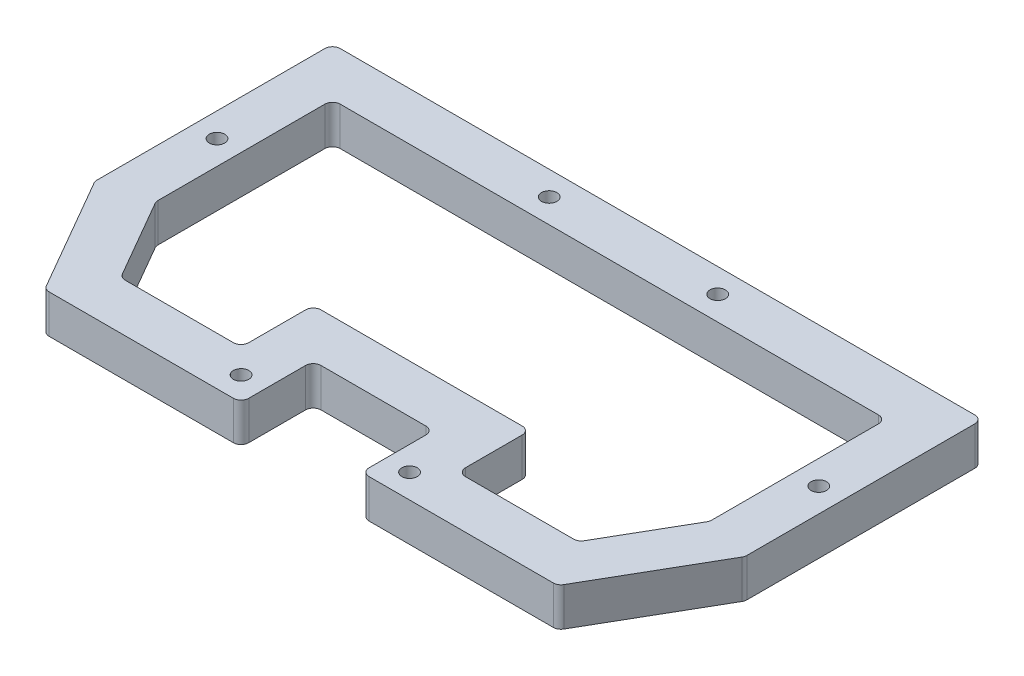
from build123d import *

# Parameters (mm, degrees)
SKETCH_1_R      = 1.6
EXTRUDE_1_DEPTH = 8
FILLET_1_R      = 1.6


with BuildPart() as part:
    # 草图1 → 凸台-拉伸1 (new body)
    with BuildSketch(Plane(origin=(0, 0, 0), x_dir=(1, 0, 0), z_dir=(0, 1, 0))):
        Polygon((-67.5, 74), (-67.5, 24.641016151), (-53.273502692, 0), (-12.5, 0), (-12.5, 15), (12.5, 15), (12.5, 0), (53.273502692, 0), (67.5, 24.641016151), (67.5, 74), align=None)
        with Locations(Location((17.5, 5, 0), (0, 0, 270))):
            Circle(SKETCH_1_R, mode=Mode.SUBTRACT)
        with Locations(Location((-62.5, 45, 0), (0, 0, 270))):
            Circle(SKETCH_1_R, mode=Mode.SUBTRACT)
        with Locations(Location((17.5, 69, 0), (0, 0, 270))):
            Circle(SKETCH_1_R, mode=Mode.SUBTRACT)
        with Locations(Location((-17.5, 5, 0), (0, 0, 90))):
            Circle(SKETCH_1_R, mode=Mode.SUBTRACT)
        with Locations(Location((-17.5, 69, 0), (0, 0, 90))):
            Circle(SKETCH_1_R, mode=Mode.SUBTRACT)
        with Locations(Location((62.5, 45, 0), (0, 0, 90))):
            Circle(SKETCH_1_R, mode=Mode.SUBTRACT)
        Polygon((-57.5, 27.320508076), (-57.5, 64), (57.5, 64), (57.5, 27.320508076), (47.5, 10), (22.5, 10), (22.5, 25), (-22.5, 25), (-22.5, 10), (-47.5, 10), align=None, mode=Mode.SUBTRACT)
    extrude(amount=EXTRUDE_1_DEPTH)

    # 圆角1
    fillet_1_edges = [part.edges().sort_by_distance(p)[0] for p in [
        (67.5, 4, -74),
        (67.5, 4, -24.641016151),
        (53.273502692, 4, 0),
        (12.5, 4, 0),
        (12.5, 4, -15),
        (-12.5, 4, -15),
        (-12.5, 4, 0),
        (-53.273502692, 4, 0),
        (-67.5, 4, -24.641016151),
        (-67.5, 4, -74),
        (57.5, 4, -27.320508076),
        (57.5, 4, -64),
        (-57.5, 4, -64),
        (-57.5, 4, -27.320508076),
        (-47.5, 4, -10),
        (-22.5, 4, -10),
        (-22.5, 4, -25),
        (22.5, 4, -25),
        (22.5, 4, -10),
        (47.5, 4, -10),
    ]]
    fillet(fillet_1_edges, radius=FILLET_1_R)


solid = part.part
